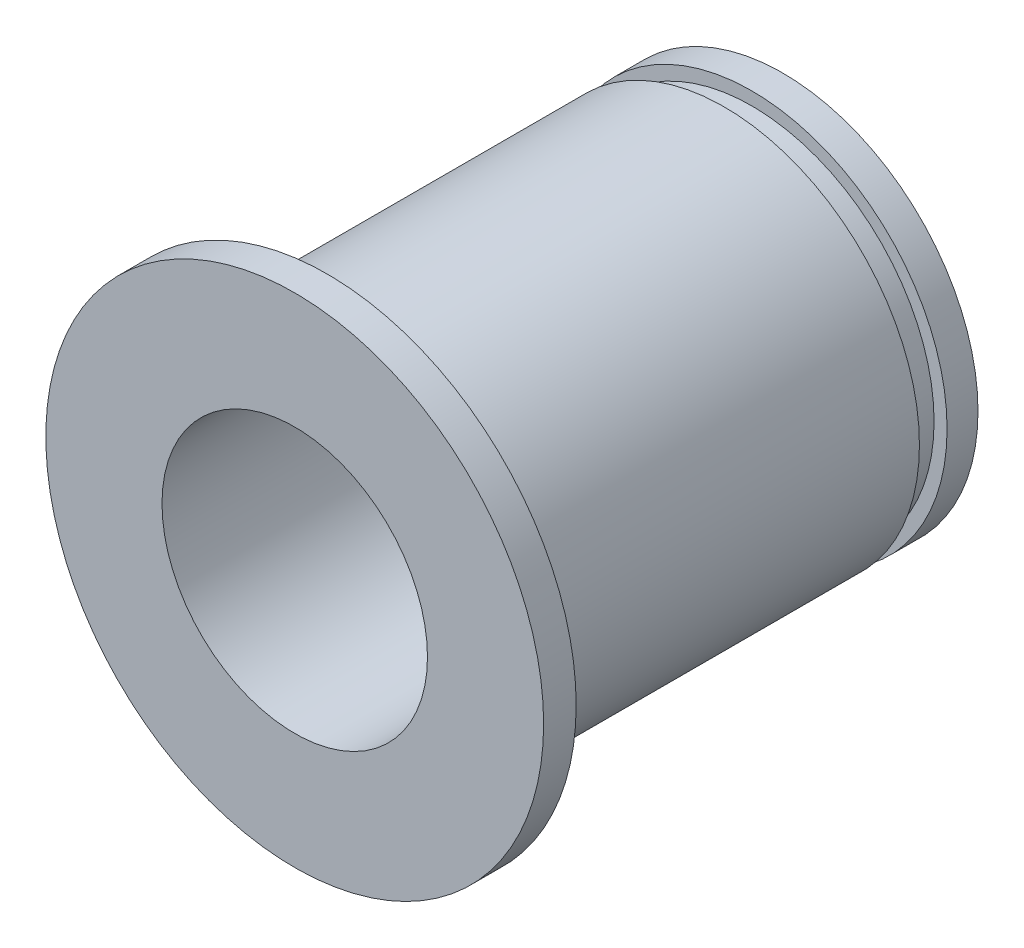
from build123d import *

# Parameters (mm, degrees)
F_01_START                                = -2
S01_GROUND_GUIDE_BORE_AND_BODY_R          = 6
S01_GROUND_GUIDE_BORE_AND_BODY_R_2        = 4.08
F_01_GROUND_GUIDE_BORE_AND_BODY_DEPTH     = 14
F_02_START                                = 12
S02_OUTBOARD_FLANGE_R                     = 7.65
S02_OUTBOARD_FLANGE_R_2                   = 4.08
F_02_OUTBOARD_FLANGE_DEPTH                = 1
F_03_START                                = -1.05
S03_EXTERNAL_RETAINING_RING_GROOVE_R      = 6.1
S03_EXTERNAL_RETAINING_RING_GROOVE_R_2    = 5.6
F_03_EXTERNAL_RETAINING_RING_GROOVE_DEPTH = 0.85


with BuildPart() as part:
    # S01 - Ground guide bore and body → 01 - Ground guide bore and body (new body)
    with BuildSketch(Plane.XY.offset(F_01_START)):
        Circle(S01_GROUND_GUIDE_BORE_AND_BODY_R)
        Circle(S01_GROUND_GUIDE_BORE_AND_BODY_R_2, mode=Mode.SUBTRACT)
    extrude(amount=F_01_GROUND_GUIDE_BORE_AND_BODY_DEPTH)

    # S02 - Outboard flange → 02 - Outboard flange (add)
    with BuildSketch(Plane.XY.offset(F_02_START)):
        Circle(S02_OUTBOARD_FLANGE_R)
        Circle(S02_OUTBOARD_FLANGE_R_2, mode=Mode.SUBTRACT)
    extrude(amount=F_02_OUTBOARD_FLANGE_DEPTH)

    # S03 - External retaining ring groove → 03 - External retaining ring groove (cut)
    with BuildSketch(Plane.XY.offset(F_03_START)):
        Circle(S03_EXTERNAL_RETAINING_RING_GROOVE_R)
        Circle(S03_EXTERNAL_RETAINING_RING_GROOVE_R_2, mode=Mode.SUBTRACT)
    extrude(amount=F_03_EXTERNAL_RETAINING_RING_GROOVE_DEPTH, mode=Mode.SUBTRACT)


solid = part.part
